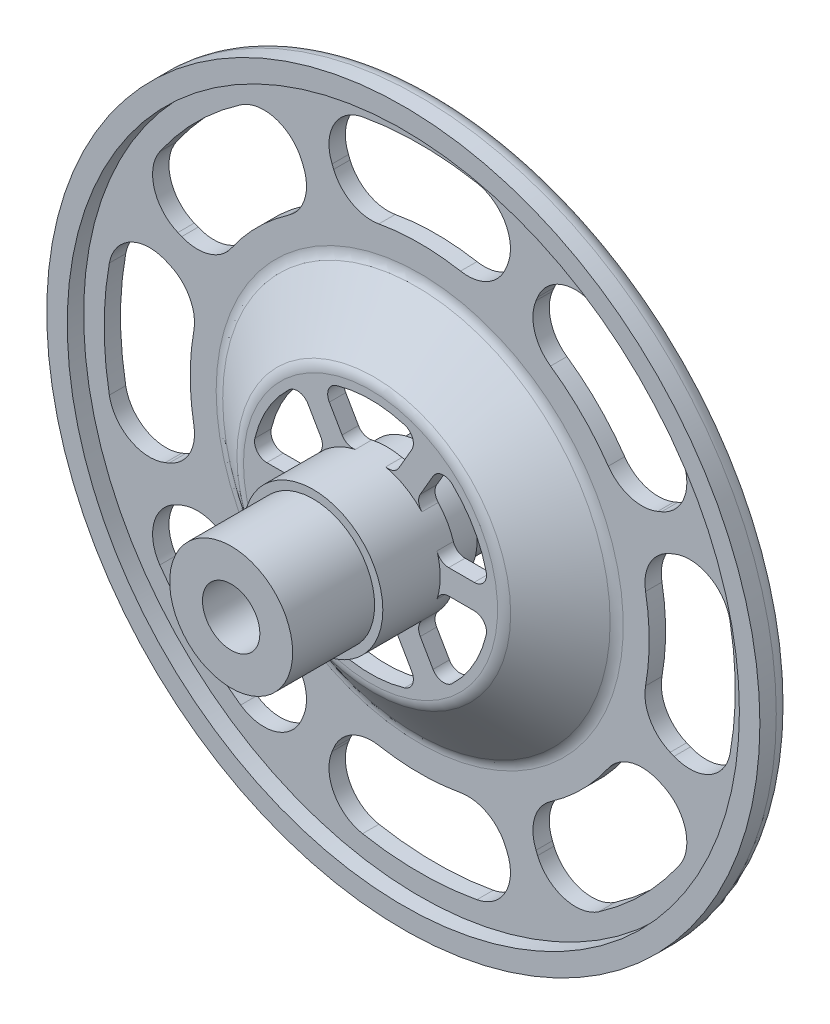
from build123d import *

# Parameters (mm, degrees)
FILLET1_R          = 2
CHAMFER1_SIZE      = 1.5
CUT_EXTRUDE1_DEPTH = 2
CIRPATTERN1_COUNT  = 8
CUT_EXTRUDE2_DEPTH = 2
CIRPATTERN2_COUNT  = 6


with BuildPart() as part:
    # Sketch2 → Revolve1 (revolve)
    with BuildSketch(Plane(origin=(0, 0, 0), x_dir=(0, 0, -1), z_dir=(1, 0, 0)), mode=Mode.PRIVATE) as revolve1_sk:
        Polygon((0, 3.5), (0, 7.5), (10, 7.5), (10, 8.5), (17, 8.5), (17, 16.166666667), (23, 24.166666667), (23, 41), (21, 41), (21, 43.5), (25, 43.5), (25, 23.5), (19, 15.5), (19, 7), (23, 7), (23, 6), (30, 6), (30, 0), (23, 0), (23, 2.5), (8, 2.5), (8, 3.5), align=None)
    revolve(revolve1_sk.sketch.rotate(Axis((0, 0, 54.509359295), (0, 0, -1)), 90), axis=Axis((0, 0, 54.509359295), (0, 0, -1)))

    # Fillet1
    fillet1_edges = [part.edges().sort_by_distance(p)[0] for p in [
        (-15.5, 0, -19),
        (-23.5, 0, -25),
        (-43.5, 0, -25),
        (-24.166666667, 0, -23),
        (-16.166666667, 0, -17),
    ]]
    fillet(fillet1_edges, radius=FILLET1_R)

    # Chamfer1
    chamfer1_edges = [part.edges().sort_by_distance(p)[0] for p in [
        (-6, 0, -30),
    ]]
    chamfer(chamfer1_edges, length=CHAMFER1_SIZE)

    # Sketch3 → Cut-Extrude1 (cut)
    with BuildSketch(Plane(origin=(0, 0, -25), x_dir=(-1, 0, 0), z_dir=(0, 0, -1))):
        with BuildLine():
            Line((-10.689139417, 31.03211721), (-10.493410806, 30.559586543))
            ThreePointArc((-10.493410806, 30.559586543), (-8.269260882, 28.084064394), (-4.984011152, 27.552851628))
            ThreePointArc((-4.984011152, 27.552851628), (0, 28), (4.984011152, 27.552851628))
            ThreePointArc((4.984011152, 27.552851628), (8.269260882, 28.084064394), (10.493410806, 30.559586543))
            Line((10.493410806, 30.559586543), (10.689139417, 31.03211721))
            ThreePointArc((10.689139417, 31.03211721), (10.46255391, 35.333672006), (6.975673359, 37.862778308))
            ThreePointArc((6.975673359, 37.862778308), (0, 38.5), (-6.975673359, 37.862778308))
            ThreePointArc((-6.975673359, 37.862778308), (-10.46255391, 35.333672006), (-10.689139417, 31.03211721))
        make_face()
    cut_extrude1 = extrude(amount=-CUT_EXTRUDE1_DEPTH, mode=Mode.SUBTRACT)

    # CirPattern1: Cut-Extrude1 ×8 about axis
    cirpattern1_axis = Axis((0, 0, 0), (0, 0, 1))
    for i in range(1, CIRPATTERN1_COUNT):
        add(cut_extrude1.rotate(cirpattern1_axis, i * 360 / CIRPATTERN1_COUNT), mode=Mode.SUBTRACT)

    # Sketch4 → Cut-Extrude2 (cut)
    with BuildSketch(Plane(origin=(0, 0, -19), x_dir=(-1, 0, 0), z_dir=(0, 0, -1))):
        with BuildLine():
            Line((-5.025517215, 11.70445115), (-3.470657901, 9.011355821))
            ThreePointArc((-3.470657901, 9.011355821), (-2.775231815, 8.388165182), (-1.845876826, 8.297152448))
            ThreePointArc((-1.845876826, 8.297152448), (0, 8.5), (1.845876826, 8.297152448))
            ThreePointArc((1.845876826, 8.297152448), (2.775231815, 8.388165182), (3.470657901, 9.011355821))
            Line((3.470657901, 9.011355821), (5.025517215, 11.70445115))
            ThreePointArc((5.025517215, 11.70445115), (5.120456748, 13.008370226), (4.156457468, 13.891503206))
            ThreePointArc((4.156457468, 13.891503206), (0, 14.5), (-4.156457468, 13.891503206))
            ThreePointArc((-4.156457468, 13.891503206), (-5.120456748, 13.008370226), (-5.025517215, 11.70445115))
        make_face()
    cut_extrude2 = extrude(amount=-CUT_EXTRUDE2_DEPTH, mode=Mode.SUBTRACT)

    # CirPattern2: Cut-Extrude2 ×6 about axis
    cirpattern2_axis = Axis((0, 0, 0), (0, 0, 1))
    for i in range(1, CIRPATTERN2_COUNT):
        add(cut_extrude2.rotate(cirpattern2_axis, i * 360 / CIRPATTERN2_COUNT), mode=Mode.SUBTRACT)


solid = part.part
